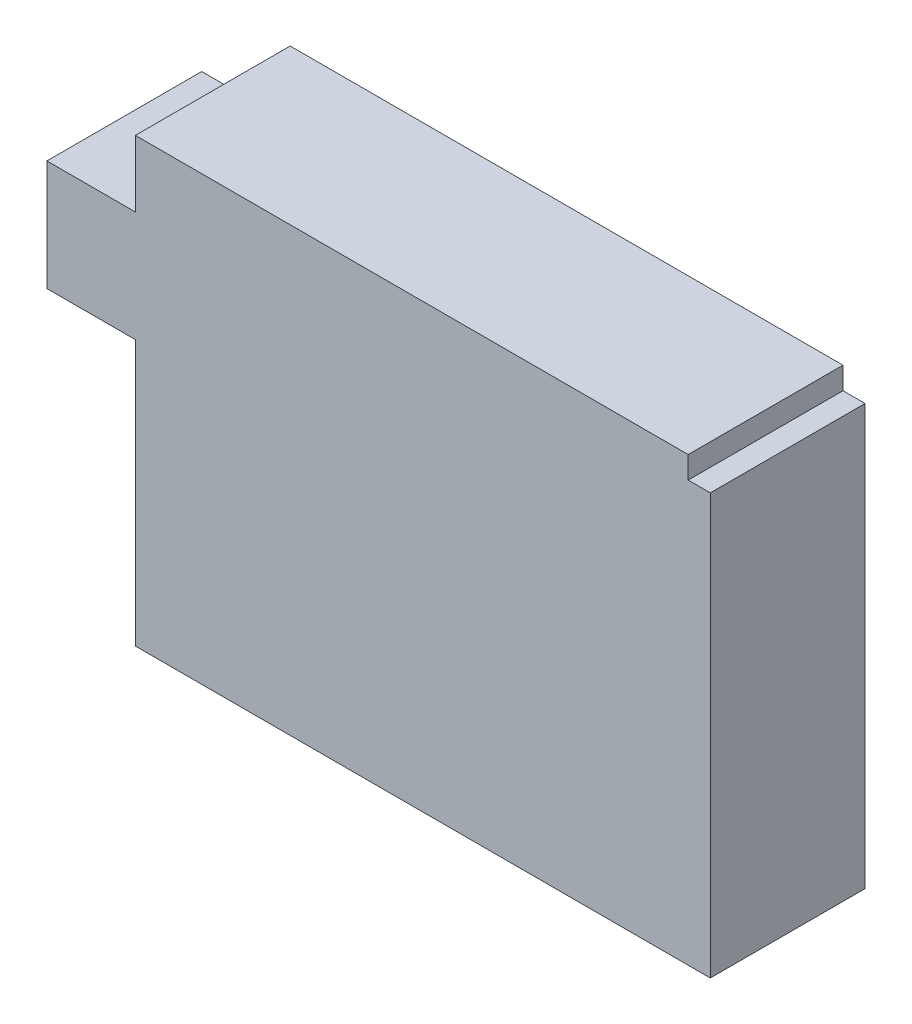
from build123d import *

# Parameters (mm, degrees)
SALIENTE_EXTRUIR1_DEPTH = 7


with BuildPart() as part:
    # Croquis1 → Saliente-Extruir1 (new body)
    with BuildSketch(Plane.XY):
        Polygon((0, 0), (0, 12), (-4, 12), (-4, 17), (0, 17), (0, 20), (25, 20), (25, 19), (26, 19), (26, 0), align=None)
    extrude(amount=SALIENTE_EXTRUIR1_DEPTH)


solid = part.part
